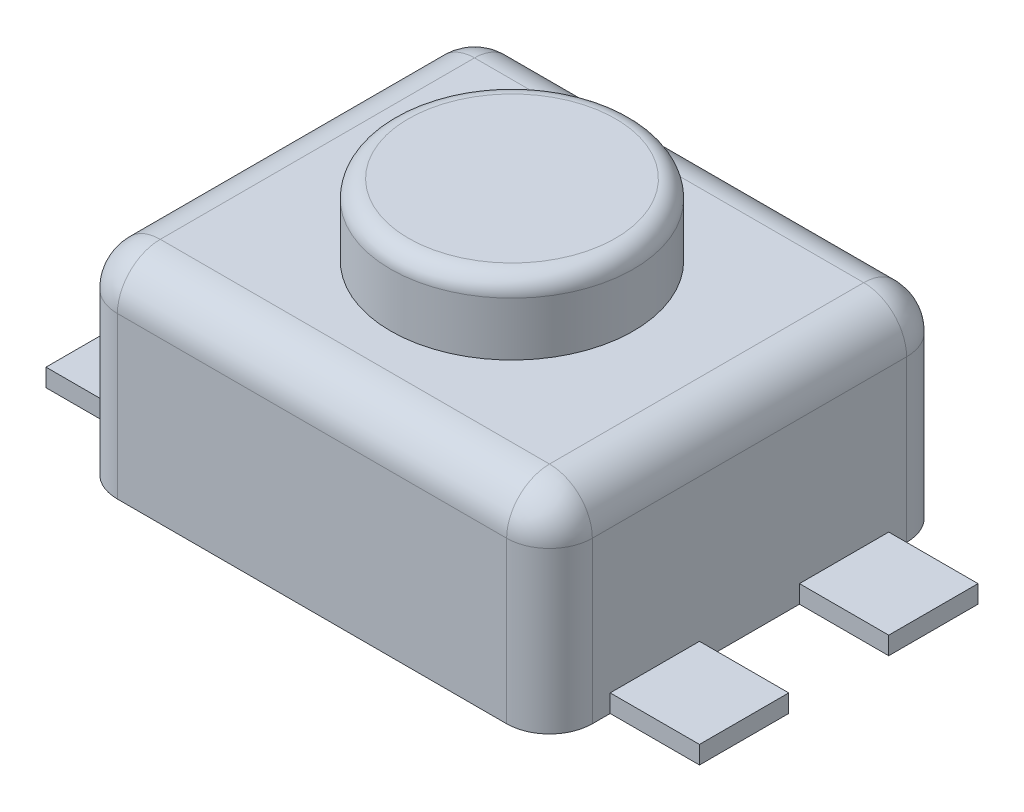
from build123d import *

# Parameters (mm, degrees)
SKETCH1_W           = 3.3782
SKETCH1_H           = 2.8448
BOSS_EXTRUDE1_DEPTH = 1.4478
FILLET1_R           = 0.3048
SKETCH2_R           = 0.8636
BOSS_EXTRUDE2_DEPTH = 0.508
FILLET2_R           = 0.127
SKETCH3_W           = 0.635
SKETCH3_H           = 0.635
BOSS_EXTRUDE3_DEPTH = 0.127


with BuildPart() as part:
    # Sketch1 → Boss-Extrude1 (new body)
    with BuildSketch(Plane(origin=(0, 0, 0), x_dir=(1, 0, 0), z_dir=(0, 1, 0))):
        Rectangle(SKETCH1_W, SKETCH1_H)
    extrude(amount=BOSS_EXTRUDE1_DEPTH)

    # Fillet1
    fillet1_edges = [part.edges().sort_by_distance(p)[0] for p in [
        (-1.6891, 1.4478, 0),
        (0, 1.4478, 1.4224),
        (1.6891, 1.4478, 0),
        (0, 1.4478, -1.4224),
        (1.6891, 0.7239, 1.4224),
        (-1.6891, 0.7239, 1.4224),
        (-1.6891, 0.7239, -1.4224),
        (1.6891, 0.7239, -1.4224),
    ]]
    fillet(fillet1_edges, radius=FILLET1_R)

    # Sketch2 → Boss-Extrude2 (add)
    with BuildSketch(Plane(origin=(0, 1.4478, 0), x_dir=(1, 0, 0), z_dir=(0, 1, 0))):
        with Locations(Location((0, 0, 0), (0, 0, 270))):
            Circle(SKETCH2_R)
    extrude(amount=BOSS_EXTRUDE2_DEPTH)

    # Fillet2
    fillet2_edges = [part.edges().sort_by_distance(p)[0] for p in [
        (0, 1.9558, -0.8636),
    ]]
    fillet(fillet2_edges, radius=FILLET2_R)

    # Sketch3 → Boss-Extrude3 (add)
    with BuildSketch(Plane(origin=(0, 0, 0), x_dir=(1, 0, 0), z_dir=(0, 1, 0))):
        with Locations((-2.0066, 0.6731)):
            Rectangle(SKETCH3_W, SKETCH3_H)
        with Locations((-2.0066, -0.6731)):
            Rectangle(SKETCH3_W, SKETCH3_H)
    boss_extrude3 = extrude(amount=BOSS_EXTRUDE3_DEPTH)

    # Mirror1: Boss-Extrude3 across plane
    add(boss_extrude3.mirror(Plane(origin=(0, 0, 0), x_dir=(0, 0, 1), z_dir=(1, 0, 0))))


solid = part.part
